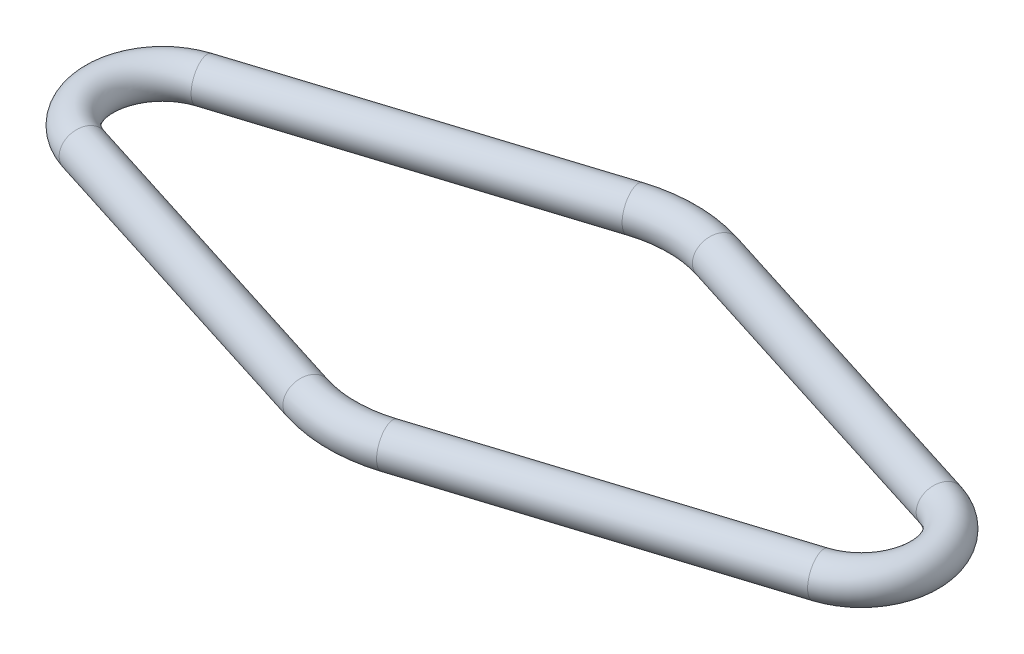
from build123d import *

# Parameters (mm, degrees)
DIA_R = 0.8


with BuildPart() as part:
    # O-Ring: sweep along a path in FlowPath
    with BuildLine(Plane(origin=(0, 0, 0), x_dir=(1, 0, 0), z_dir=(0, 1, 0))) as o_ring_path:
        Line((-15.184570413, -2.478799965), (-1.689843966, -6.750045425))
        ThreePointArc((-1.689843966, -6.750045425), (0, -7.011091653), (1.689843966, -6.750045425))
        Line((1.689843966, -6.750045425), (15.184570413, -2.478799965))
        ThreePointArc((15.184570413, -2.478799965), (17, 0), (15.184570413, 2.478799965))
        Line((15.184570413, 2.478799965), (1.689843966, 6.750045425))
        ThreePointArc((1.689843966, 6.750045425), (0, 7.011091653), (-1.689843966, 6.750045425))
        Line((-1.689843966, 6.750045425), (-15.184570413, 2.478799965))
        ThreePointArc((-15.184570413, 2.478799965), (-17, 0), (-15.184570413, -2.478799965))
    # Dia → O-Ring (sweep)
    with BuildSketch(Plane(origin=(-1.689843966, 0, 6.750045425), x_dir=(0.3017578509861242, 0, -0.9533846020196866), z_dir=(0.9533846020196866, 0, 0.3017578509861242))):
        Circle(DIA_R)
    sweep(path=o_ring_path.line)


solid = part.part
